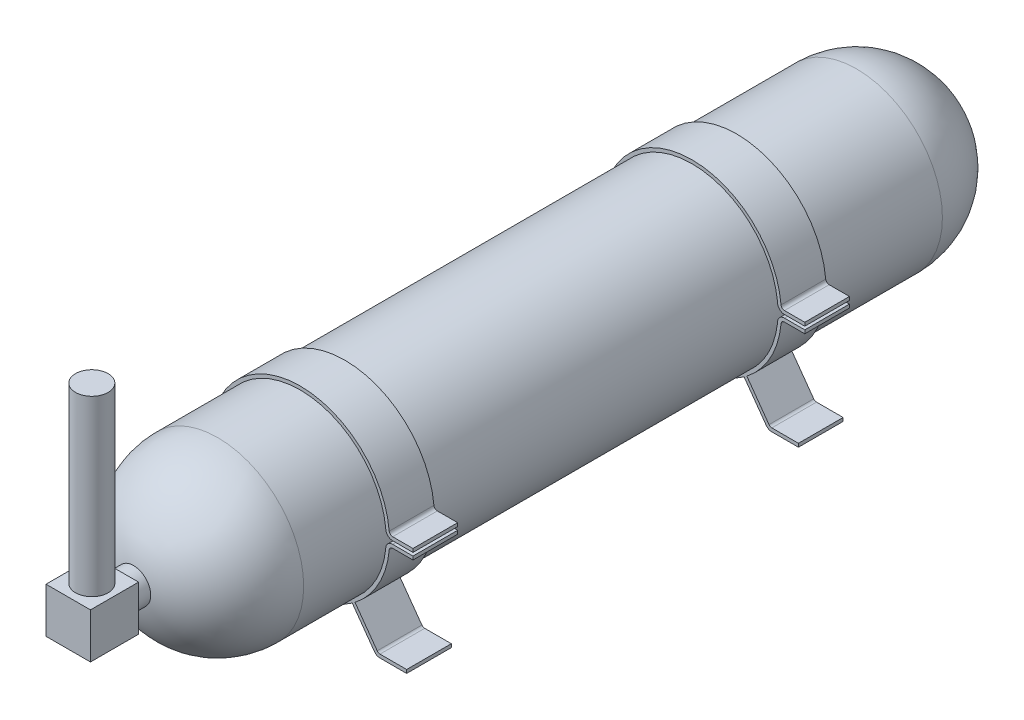
from build123d import *

# Parameters (mm, degrees)
BOSS_EXTRUDE1_DEPTH   = 130
BOSS_EXTRUDE1_2_DEPTH = 130
LPATTERN1_COUNT       = 2
LPATTERN1_PITCH       = 1140
SKETCH3_R             = 50
BOSS_EXTRUDE2_DEPTH   = 295
SKETCH4_W             = 129.401217748
SKETCH4_H             = 131.380212956
BOSS_EXTRUDE3_DEPTH   = 140
SKETCH5_R             = 47.39469976
BOSS_EXTRUDE4_DEPTH   = 505


with BuildPart() as part:
    # Sketch1 → Revolve1 (revolve)
    with BuildSketch(Plane(origin=(0, 0, 0), x_dir=(0, 0, -1), z_dir=(1, 0, 0))):
        with BuildLine():
            Line((0, 250), (1858.43373494, 250))
            ThreePointArc((1858.43373494, 250), (2035.210430236, 176.776695297), (2108.43373494, 0))
            Line((2108.43373494, 0), (-250, 0))
            ThreePointArc((-250, 0), (-176.776695297, 176.776695297), (0, 250))
        make_face()
    revolve(axis=Axis((0, 0, 0), (0, 0, -1)))

    # Sketch3 → Boss-Extrude2 (add)
    with BuildSketch(Plane.XY):
        with Locations(Location((0, 0, 0), (0, 0, 180))):
            Circle(SKETCH3_R)
    extrude(amount=BOSS_EXTRUDE2_DEPTH)

    # Sketch4 → Boss-Extrude3 (add)
    with BuildSketch(Plane.XY.offset(295)):
        Rectangle(SKETCH4_W, SKETCH4_H)
    extrude(amount=BOSS_EXTRUDE3_DEPTH)

    # Sketch5 → Boss-Extrude4 (add)
    with BuildSketch(Plane(origin=(0, 65.690106478, 0), x_dir=(1, 0, 0), z_dir=(0, 1, 0))):
        with Locations(Location((0, -366.379117065, 0), (0, 0, 90))):
            Circle(SKETCH5_R)
    extrude(amount=BOSS_EXTRUDE4_DEPTH)


with BuildPart() as body_2:
    # Sketch2 → Boss-Extrude1 (new body)
    with BuildSketch(Plane.XY.offset(-240)):
        with BuildLine():
            Line((-151.424925941, -211.353949109), (-215.824341042, -301.2405422))
            ThreePointArc((-215.824341042, -301.2405422), (-222.943448369, -307.382375758), (-232.082337127, -309.592470973))
            Line((-232.082337127, -309.592470973), (-309.583759824, -309.592470973))
            Line((-309.583759824, -309.592470973), (-309.583759824, -299.592470973))
            Line((-309.583759824, -299.592470973), (-232.082337127, -299.592470973))
            ThreePointArc((-232.082337127, -299.592470973), (-227.512892748, -298.487423366), (-223.953339085, -295.416506586))
            Line((-223.953339085, -295.416506586), (-159.441881848, -205.373528754))
            ThreePointArc((-159.441881848, -205.373528754), (-228.064688771, -124.845895952), (-258.922583458, -23.64520618))
            ThreePointArc((-258.922583458, -23.64520618), (-262.139271849, -17.169032605), (-268.881144361, -14.554637187))
            Line((-268.881144361, -14.554637187), (-328.009869917, -14.554637187))
            Line((-328.009869917, -14.554637187), (-328.009869917, -4.554637187))
            Line((-328.009869917, -4.554637187), (-268.881144361, -4.554637187))
            ThreePointArc((-268.881144361, -4.554637187), (-255.397399337, -9.783428024), (-248.964022556, -22.735775173))
            ThreePointArc((-248.964022556, -22.735775173), (0, -250), (248.964022556, -22.735775173))
            ThreePointArc((248.964022556, -22.735775173), (255.397399337, -9.783428024), (268.881144361, -4.554637187))
            Line((268.881144361, -4.554637187), (328.009869917, -4.554637187))
            Line((328.009869917, -4.554637187), (328.009869917, -14.554637187))
            Line((328.009869917, -14.554637187), (268.881144361, -14.554637187))
            ThreePointArc((268.881144361, -14.554637187), (262.139271849, -17.169032605), (258.922583458, -23.64520618))
            ThreePointArc((258.922583458, -23.64520618), (228.064688771, -124.845895952), (159.441881848, -205.373528754))
            Line((159.441881848, -205.373528754), (223.953339085, -295.416506586))
            ThreePointArc((223.953339085, -295.416506586), (227.512892748, -298.487423366), (232.082337127, -299.592470973))
            Line((232.082337127, -299.592470973), (309.583759824, -299.592470973))
            Line((309.583759824, -299.592470973), (309.583759824, -309.592470973))
            Line((309.583759824, -309.592470973), (232.082337127, -309.592470973))
            ThreePointArc((232.082337127, -309.592470973), (222.943448369, -307.382375758), (215.824341042, -301.2405422))
            Line((215.824341042, -301.2405422), (151.424925941, -211.353949109))
            ThreePointArc((151.424925941, -211.353949109), (0, -260), (-151.424925941, -211.353949109))
        make_face()
    boss_extrude1 = extrude(amount=-BOSS_EXTRUDE1_DEPTH)


with BuildPart() as body_3:
    # Sketch2 → Boss-Extrude1 2 (new body)
    with BuildSketch(Plane.XY.offset(-240)):
        with BuildLine():
            Line((-268.881144361, 4.554637187), (-328.009869917, 4.554637187))
            Line((-328.009869917, 4.554637187), (-328.009869917, 14.554637187))
            Line((-328.009869917, 14.554637187), (-268.881144361, 14.554637187))
            ThreePointArc((-268.881144361, 14.554637187), (-262.139271849, 17.169032605), (-258.922583458, 23.64520618))
            ThreePointArc((-258.922583458, 23.64520618), (0, 260), (258.922583458, 23.64520618))
            ThreePointArc((258.922583458, 23.64520618), (262.139271849, 17.169032605), (268.881144361, 14.554637187))
            Line((268.881144361, 14.554637187), (328.009869917, 14.554637187))
            Line((328.009869917, 14.554637187), (328.009869917, 4.554637187))
            Line((328.009869917, 4.554637187), (268.881144361, 4.554637187))
            ThreePointArc((268.881144361, 4.554637187), (255.397399337, 9.783428024), (248.964022556, 22.735775173))
            ThreePointArc((248.964022556, 22.735775173), (0, 250), (-248.964022556, 22.735775173))
            ThreePointArc((-248.964022556, 22.735775173), (-255.397399337, 9.783428024), (-268.881144361, 4.554637187))
        make_face()
    boss_extrude1_2 = extrude(amount=-BOSS_EXTRUDE1_2_DEPTH)


with BuildPart() as lpattern1_1:
    # LPattern1: Boss-Extrude1, Boss-Extrude1 2 ×2
    with Locations(*[(0, 0, -i * LPATTERN1_PITCH) for i in range(1, LPATTERN1_COUNT)]):
        add(boss_extrude1)
        add(boss_extrude1_2)


solid = Compound([part.part, body_2.part, body_3.part, lpattern1_1.part])
